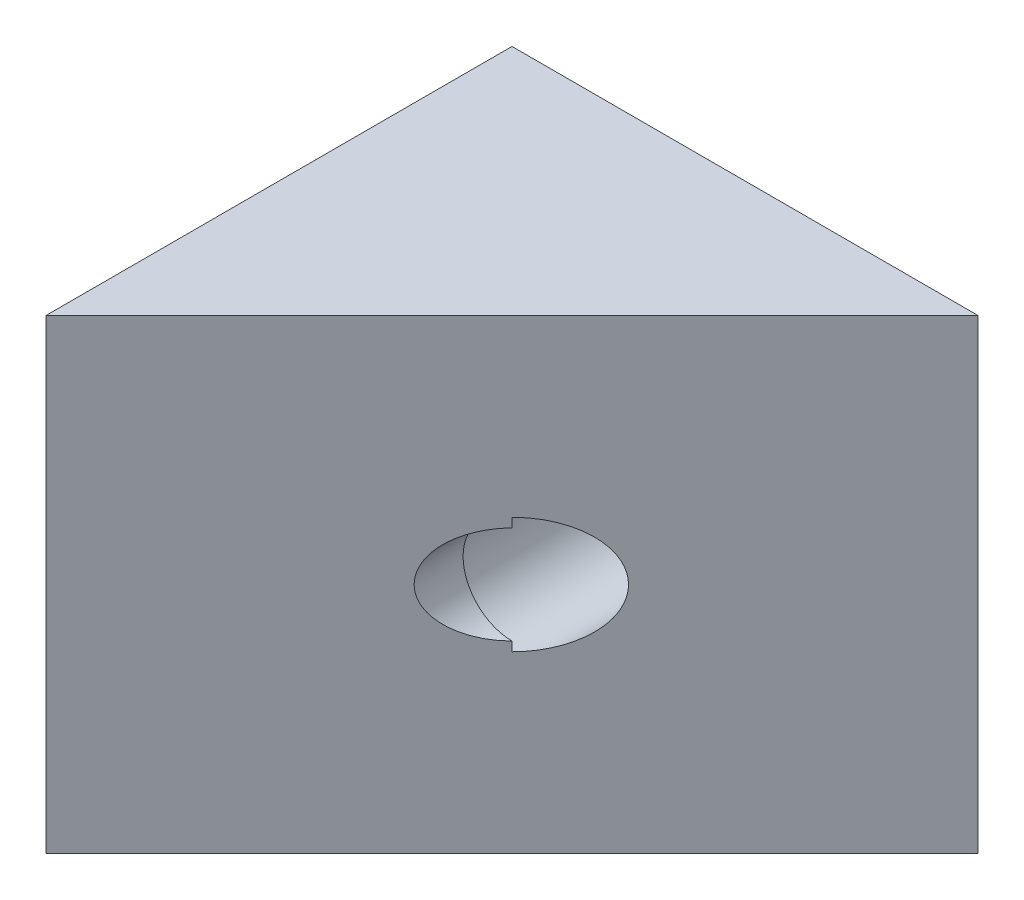
from build123d import *

# Parameters (mm, degrees)
EXTRUDE_1_DEPTH              = 10
HOLE_WIZARD_M5_1_D           = 4.2
HOLE_WIZARD_M5_1_DEPTH       = 14
HOLE_WIZARD_M5_1_CBORE_D     = 5
HOLE_WIZARD_M5_1_CBORE_DEPTH = 10
HOLE_WIZARD_M5_1_TIP         = 1.2618073


with BuildPart() as part:
    # 草图1 → 凸台-拉伸1 (new, symmetric)
    with BuildSketch(Plane(origin=(0, 0, 0), x_dir=(1, 0, 0), z_dir=(0, 1, 0))):
        Polygon((0, 0), (20, 0), (0, -20), align=None)
    extrude(amount=EXTRUDE_1_DEPTH, both=True)

    # M5 螺纹孔1
    with Locations(Plane(origin=(0, 0, 0), x_dir=(-1, 0, 0), z_dir=(0, 0, -1))):
        with Locations((-10, 0)):
            CounterBoreHole(HOLE_WIZARD_M5_1_D / 2, HOLE_WIZARD_M5_1_CBORE_D / 2, HOLE_WIZARD_M5_1_CBORE_DEPTH, depth=HOLE_WIZARD_M5_1_DEPTH)
            with Locations((0, 0, -(HOLE_WIZARD_M5_1_DEPTH + HOLE_WIZARD_M5_1_TIP / 2))):  # 118° drill point
                Cone(0, HOLE_WIZARD_M5_1_D / 2, HOLE_WIZARD_M5_1_TIP, mode=Mode.SUBTRACT)


solid = part.part
